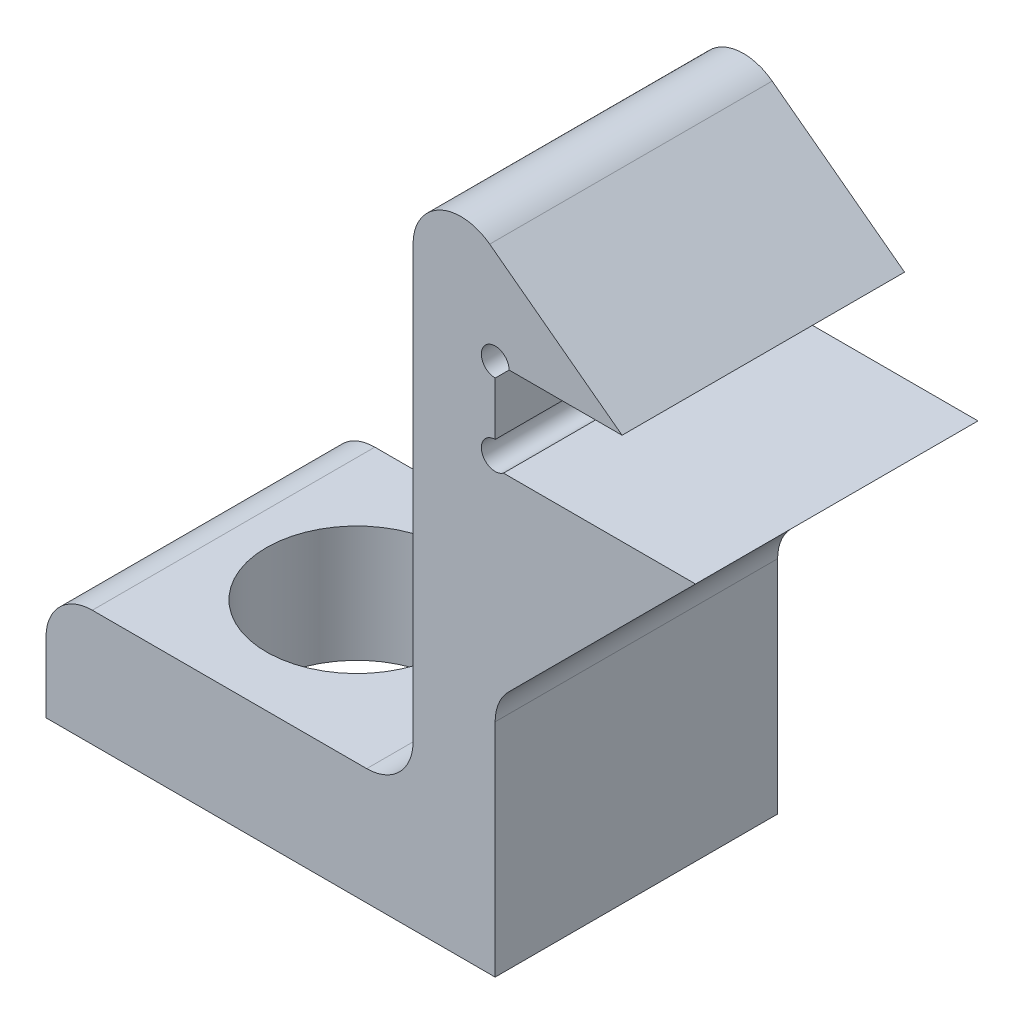
from build123d import *

# Parameters (mm, degrees)
BOSS_EXTRUDE1_DEPTH = 2.5
SKETCH4_R           = 1.6
CUT_EXTRUDE1_DEPTH  = 13.486214373


with BuildPart() as part:
    # Sketch3 → Boss-Extrude1 (new, symmetric)
    with BuildSketch(Plane.XY):
        with BuildLine():
            Line((-1.45304318, 2.879645015), (-1.45304318, 10.509737409))
            ThreePointArc((-1.45304318, 10.509737409), (-0.984259086, 11.268173328), (-0.096253627, 11.18798683))
            Line((-0.096253627, 11.18798683), (2.246891916, 9.43))
            Line((2.246891916, 9.43), (0.246891916, 9.43))
            ThreePointArc((0.246891916, 9.43), (-0.172404049, 9.603678075), (0.001274026, 9.18438211))
            Line((0.001274026, 9.18438211), (0.001274026, 8.242847777))
            ThreePointArc((0.001274026, 8.242847777), (-0.231933324, 7.920142408), (0.147658859, 7.8))
            Line((0.147658859, 7.8), (3.54695682, 7.8))
            Line((3.54695682, 7.8), (0.23979919, 4.492842832))
            ThreePointArc((0.23979919, 4.492842832), (0.062321779, 4.227229147), (0, 3.913916433))
            Line((0, 3.913916433), (0, 0))
            Line((0, 0), (-7.95, 0))
            Line((-7.95, 0), (-7.95, 1.239645015))
            ThreePointArc((-7.95, 1.239645015), (-7.709827561, 1.819472575), (-7.13, 2.059645015))
            Line((-7.13, 2.059645015), (-2.27304318, 2.059645015))
            ThreePointArc((-2.27304318, 2.059645015), (-1.69321562, 2.299817454), (-1.45304318, 2.879645015))
        make_face()
    extrude(amount=BOSS_EXTRUDE1_DEPTH, both=True)

    # Sketch4 → Cut-Extrude1 (cut, through all)
    with BuildSketch(Plane(origin=(0, 2.059645015, 0), x_dir=(1, 0, 0), z_dir=(0, 1, 0))):
        with Locations(Location((-4.95, 0, 0), (0, 0, 180))):
            Circle(SKETCH4_R)
    extrude(amount=-CUT_EXTRUDE1_DEPTH, mode=Mode.SUBTRACT)


solid = part.part
